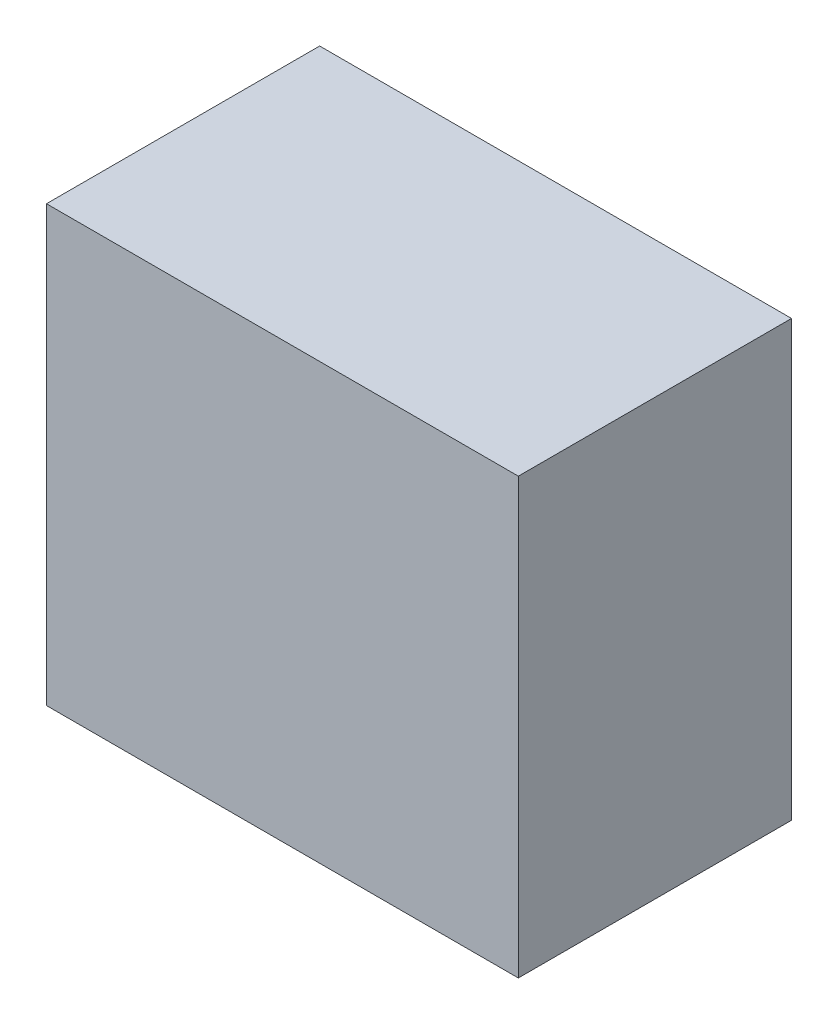
from build123d import *

# Parameters (mm, degrees)
SKETCH_1_W      = 38
SKETCH_1_H      = 35
EXTRUDE_1_DEPTH = 22


with BuildPart() as part:
    # 草图1 → 凸台-拉伸1 (new body)
    with BuildSketch(Plane.XY):
        Rectangle(SKETCH_1_W, SKETCH_1_H)
    extrude(amount=EXTRUDE_1_DEPTH)


solid = part.part
